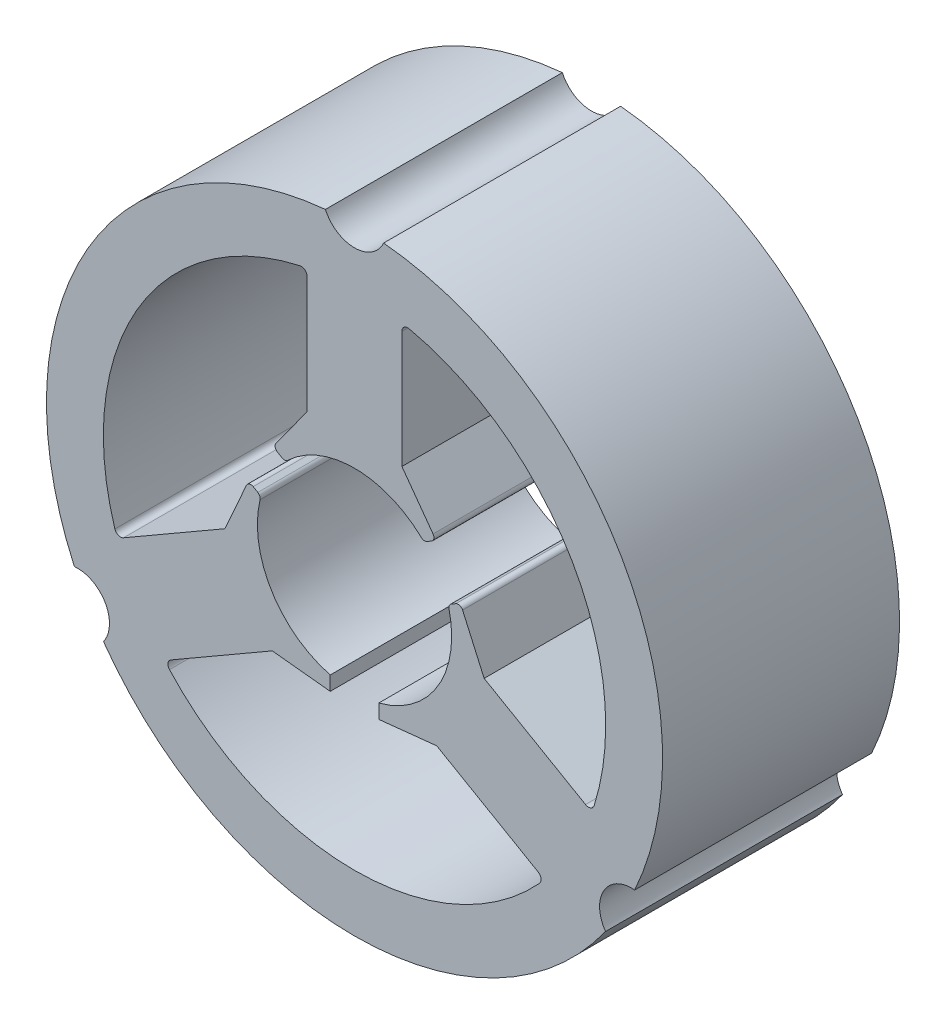
from build123d import *

# Parameters (mm, degrees)
SKETCH_1_R               = 4.1
EXTRUDE_1_DEPTH          = 10
CUT_EXTRUDE_1_DEPTH      = 10
PATTERN_CIRCULAR_1_COUNT = 3
FILLET_1_R               = 0.2


with BuildPart() as part:
    # 草图1 → 凸台-拉伸1 (new body)
    with BuildSketch(Plane.XY):
        with BuildLine():
            ThreePointArc((-1.229173411, 12.941759259), (-11.258330249, 6.5), (-11.822478994, -5.40638423))
            ThreePointArc((-11.822478994, -5.40638423), (-10.522208656, -6.075), (-10.593305582, -7.53537503))
            ThreePointArc((-10.593305582, -7.53537503), (0, -13), (10.593305582, -7.53537503))
            ThreePointArc((10.593305582, -7.53537503), (10.522208656, -6.075), (11.822478994, -5.40638423))
            ThreePointArc((11.822478994, -5.40638423), (11.258330249, 6.5), (1.229173411, 12.941759259))
            ThreePointArc((1.229173411, 12.941759259), (0, 12.15), (-1.229173411, 12.941759259))
        make_face()
        Circle(SKETCH_1_R, mode=Mode.SUBTRACT)
    extrude(amount=EXTRUDE_1_DEPTH)

    # 草图2 → 切除-拉伸1 (cut)
    with BuildSketch(Plane.XY):
        with BuildLine():
            Line((-7.748999943, -6.78328828), (-3.470031597, -4.312824754))
            Line((-3.470031597, -4.312824754), (-1.025, -4.56980793))
            Line((-1.025, -4.56980793), (-1.025, -3.96980793))
            ThreePointArc((-1.025, -3.96980793), (0, -4.1), (1.025, -3.96980793))
            Line((1.025, -3.96980793), (1.025, -4.56980793))
            Line((1.025, -4.56980793), (3.470031597, -4.312824754))
            Line((3.470031597, -4.312824754), (7.748999943, -6.78328828))
            ThreePointArc((7.748999943, -6.78328828), (7.871108829, -6.961884233), (7.808154531, -7.168871796))
            ThreePointArc((7.808154531, -7.168871796), (0, -10.6), (-7.808154531, -7.168871796))
            ThreePointArc((-7.808154531, -7.168871796), (-7.871108829, -6.961884233), (-7.748999943, -6.78328828))
        make_face()
    cut_extrude_1 = extrude(amount=CUT_EXTRUDE_1_DEPTH, mode=Mode.SUBTRACT)

    # 阵列(圆周)1: 切除-拉伸1 ×3 about axis
    pattern_circular_1_axis = Axis((0, 0, 0), (0, 0, 1))
    for i in range(1, PATTERN_CIRCULAR_1_COUNT):
        add(cut_extrude_1.rotate(pattern_circular_1_axis, i * 360 / PATTERN_CIRCULAR_1_COUNT), mode=Mode.SUBTRACT)

    # 圆角1
    fillet_1_edges = [part.edges().sort_by_distance(p)[0] for p in [
        (3.445069758, 3.172580004, 5),
        (2.925454515, 2.872580004, 5),
        (3.950454515, 1.097227926, 5),
        (4.470069758, 1.397227926, 5),
        (-4.470069758, 1.397227926, 5),
        (-3.950454515, 1.097227926, 5),
        (-2.925454515, 2.872580004, 5),
        (-3.445069758, 3.172580004, 5),
    ]]
    fillet(fillet_1_edges, radius=FILLET_1_R)


solid = part.part
